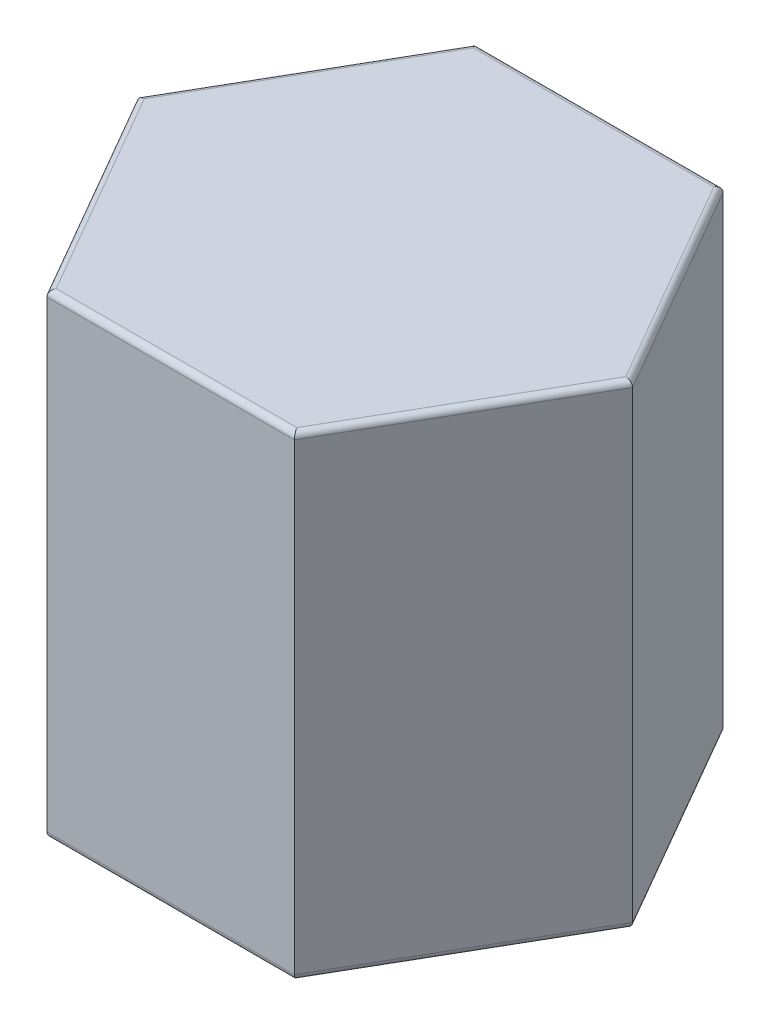
from build123d import *

# Parameters (mm, degrees)
BOSS_EXTRUDE1_DEPTH = 40
FILLET1_R           = 0.5


with BuildPart() as part:
    # Sketch1 → Boss-Extrude1 (new body)
    with BuildSketch(Plane(origin=(0, 0, 0), x_dir=(-1, 0, 0), z_dir=(0, 1, 0))):
        Polygon((-10.423602647, 18.05420848), (10.421696815, 18.05420848), (20.844346546, 0.001649597), (10.421696815, -18.050909286), (-10.423602647, -18.050909286), (-20.846252377, 0.001649597), align=None)
    extrude(amount=BOSS_EXTRUDE1_DEPTH)

    # Fillet1
    fillet1_edges = [part.edges().sort_by_distance(p)[0] for p in [
        (0.000952916, 40, -18.050909286),
        (-15.63302168, 40, -9.024629844),
        (-15.63302168, 40, 9.027929039),
        (0.000952916, 40, 18.05420848),
        (15.634927512, 40, 9.027929039),
        (0.000952916, 0, 18.05420848),
        (-15.63302168, 0, 9.027929039),
        (-15.63302168, 0, -9.024629844),
        (0.000952916, 0, -18.050909286),
        (15.634927512, 0, -9.024629844),
        (15.634927512, 0, 9.027929039),
        (15.634927512, 40, -9.024629844),
    ]]
    fillet(fillet1_edges, radius=FILLET1_R)


solid = part.part
